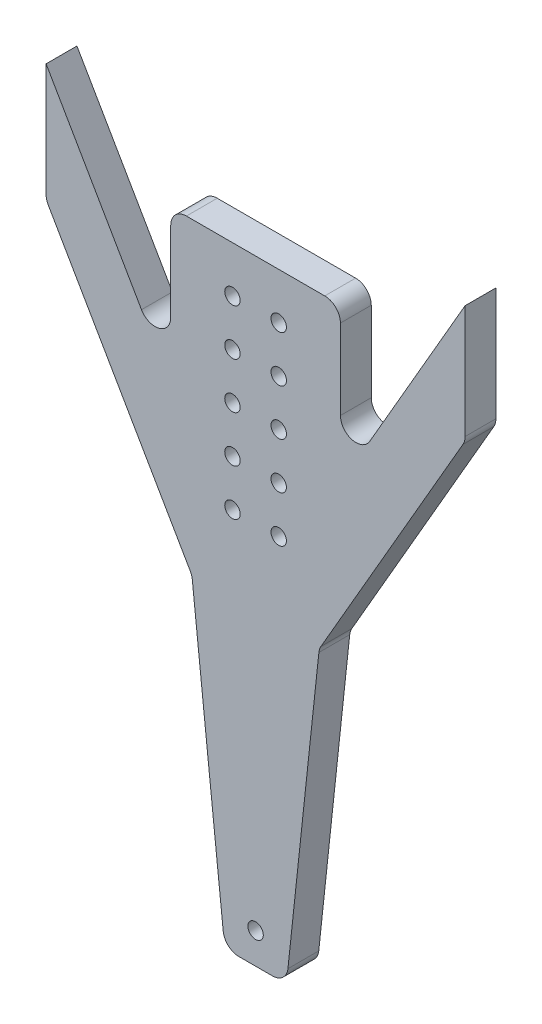
from build123d import *

# Parameters (mm, degrees)
BOSS_EXTRUDE1_DEPTH   = 10
FILLET1_R             = 5.08
F_5_0MM_DOWEL_HOLE1_D = 5
SKETCH14_R            = 2.5
CUT_EXTRUDE1_DEPTH    = 139.252681223
LPATTERN1_COUNT       = 5
LPATTERN1_PITCH       = 15


with BuildPart() as part:
    # Sketch1 → Boss-Extrude1 (new body)
    with BuildSketch(Plane.XY):
        Polygon((27.510468203, 50), (67.924987047, 120), (67.924987047, 81.9), (20.64, 0), (10, -99.432340815), (-10, -99.432340815), (-20.64, 0), (-67.924987047, 81.9), (-67.924987047, 120), (-27.510468203, 50), (-27.510468203, 100), (27.510468203, 100), align=None)
    extrude(amount=BOSS_EXTRUDE1_DEPTH)

    # Fillet1
    fillet1_edges = [part.edges().sort_by_distance(p)[0] for p in [
        (-27.510468203, 100, 5),
        (27.510468203, 100, 5),
        (27.510468203, 50, 5),
        (67.924987047, 81.9, 5),
        (20.64, 0, 5),
        (10, -99.432340815, 5),
        (-10, -99.432340815, 5),
        (-20.64, 0, 5),
        (-67.924987047, 81.9, 5),
        (-27.510468203, 50, 5),
    ]]
    fillet(fillet1_edges, radius=FILLET1_R)

    # Ø5.0mm Dowel Hole1 (through all)
    with Locations(Plane(origin=(0, 0, 0), x_dir=(-1, 0, 0), z_dir=(0, 0, -1))):
        with Locations((7.5, 25), (-7.5, 25)):
            f_5_0mm_dowel_hole1 = Hole(F_5_0MM_DOWEL_HOLE1_D / 2)

    # Sketch14 → Cut-Extrude1 (cut, through all)
    with BuildSketch(Plane.XY.offset(10)):
        with Locations((0, -89.432340815)):
            Circle(SKETCH14_R)
    extrude(amount=-CUT_EXTRUDE1_DEPTH, mode=Mode.SUBTRACT)

    # LPattern1: Ø5.0mm Dowel Hole1 ×5
    with Locations(*[(0, i * LPATTERN1_PITCH, 0) for i in range(1, LPATTERN1_COUNT)]):
        add(f_5_0mm_dowel_hole1, mode=Mode.SUBTRACT)


solid = part.part
